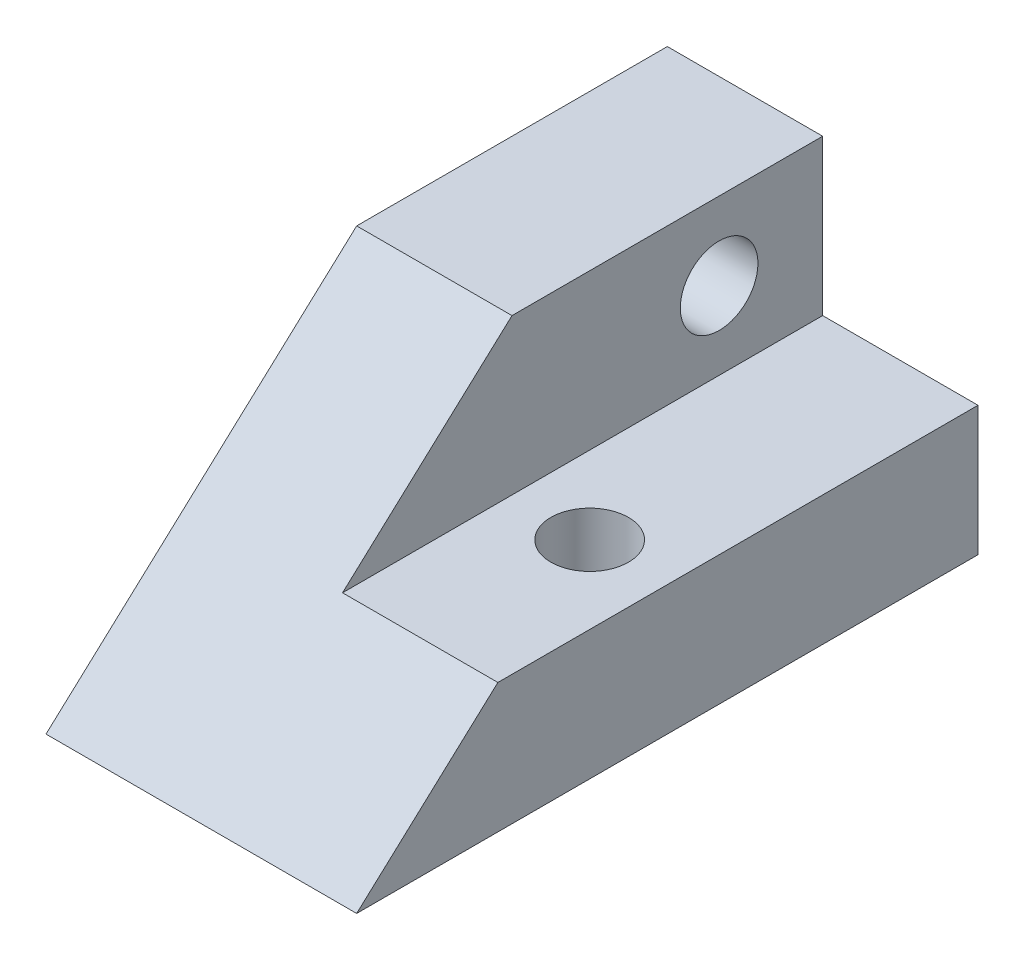
from build123d import *

# Parameters (mm, degrees)
SKETCH1_W           = 60
SKETCH1_H           = 120
BOSS_EXTRUDE1_DEPTH = 55
CUT_EXTRUDE1_DEPTH  = 146
SKETCH3_W           = 30
SKETCH3_H           = 30
CUT_EXTRUDE2_DEPTH  = 136.369863707
SKETCH5_R           = 7.5
CUT_EXTRUDE3_DEPTH  = 136.369863707
SKETCH6_R           = 7.5
CUT_EXTRUDE4_DEPTH  = 128.279220614


with BuildPart() as part:
    # Sketch1 → Boss-Extrude1 (new body)
    with BuildSketch(Plane(origin=(0, 0, 0), x_dir=(1, 0, 0), z_dir=(0, 1, 0))):
        with Locations((0, 60)):
            Rectangle(SKETCH1_W, SKETCH1_H)
    extrude(amount=BOSS_EXTRUDE1_DEPTH)

    # Sketch2 → Cut-Extrude1 (cut, through all)
    with BuildSketch(Plane(origin=(30, 0, 0), x_dir=(0, 0, -1), z_dir=(1, 0, 0))):
        Polygon((0, 0), (60, 55), (0, 55), align=None)
    extrude(amount=-CUT_EXTRUDE1_DEPTH, mode=Mode.SUBTRACT)

    # Sketch3 → Cut-Extrude2 (cut, through all)
    with BuildSketch(Plane(origin=(0, 0, -120), x_dir=(-1, 0, 0), z_dir=(0, 0, -1))):
        with Locations((-15, 40)):
            Rectangle(SKETCH3_W, SKETCH3_H)
    extrude(amount=-CUT_EXTRUDE2_DEPTH, mode=Mode.SUBTRACT)

    # Sketch5 → Cut-Extrude3 (cut, through all)
    with BuildSketch(Plane(origin=(0, 0, 0), x_dir=(0, 0, -1), z_dir=(1, 0, 0))):
        with Locations((100, 40)):
            Circle(SKETCH5_R)
    extrude(amount=-CUT_EXTRUDE3_DEPTH, mode=Mode.SUBTRACT)

    # Sketch6 → Cut-Extrude4 (cut, through all)
    with BuildSketch(Plane(origin=(0, 25, 0), x_dir=(1, 0, 0), z_dir=(0, 1, 0))):
        with Locations(Location((15, 60, 0), (0, 0, 270))):
            Circle(SKETCH6_R)
    extrude(amount=-CUT_EXTRUDE4_DEPTH, mode=Mode.SUBTRACT)


solid = part.part
